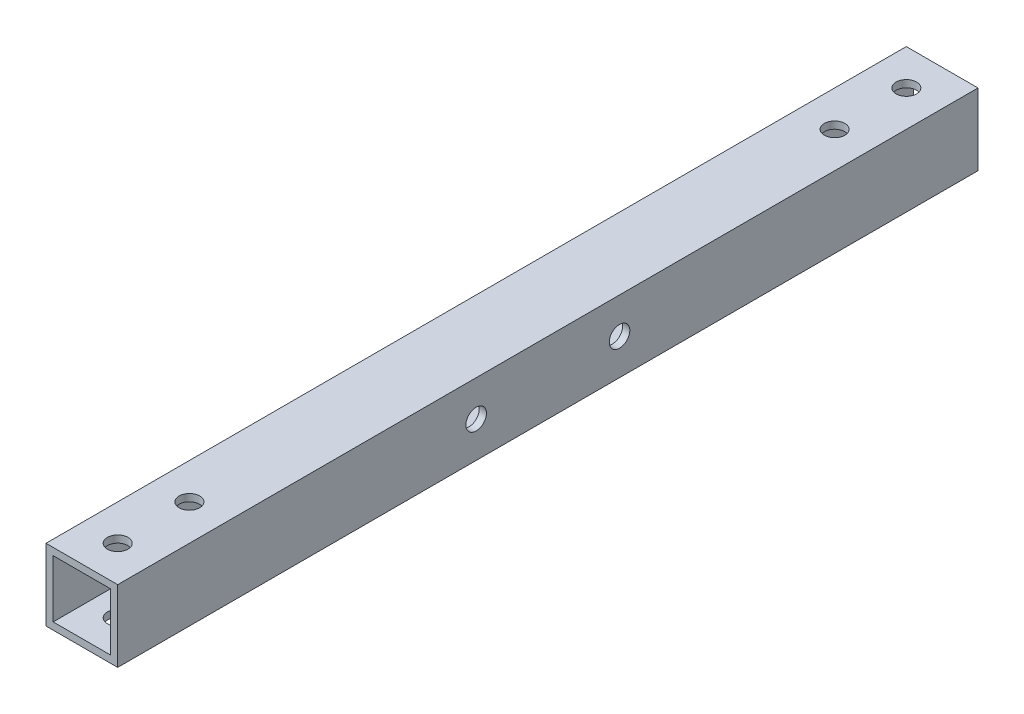
from build123d import *

# Parameters (mm, degrees)
SKETCH_1_W          = 15
SKETCH_1_H          = 15
SKETCH_1_W_2        = 12
SKETCH_1_H_2        = 12
EXTRUDE_1_DEPTH     = 180
SKETCH_3_R          = 2.15
CUT_EXTRUDE_2_DEPTH = 181.779561898
SKETCH_4_R          = 2.15
CUT_EXTRUDE_3_DEPTH = 181.779561898


with BuildPart() as part:
    # ｽｹｯﾁ1 → 押し出し-薄板1 (new body)
    with BuildSketch(Plane.XY):
        Rectangle(SKETCH_1_W, SKETCH_1_H)
        Rectangle(SKETCH_1_W_2, SKETCH_1_H_2, mode=Mode.SUBTRACT)
    extrude(amount=EXTRUDE_1_DEPTH)

    # ｽｹｯﾁ3 → ｶｯﾄ - 押し出し2 (cut, through all)
    with BuildSketch(Plane(origin=(7.5, 0, 0), x_dir=(0, 0, -1), z_dir=(1, 0, 0))):
        with Locations((-75, 0)):
            Circle(SKETCH_3_R)
        with Locations((-105, 0)):
            Circle(SKETCH_3_R)
    extrude(amount=-CUT_EXTRUDE_2_DEPTH, mode=Mode.SUBTRACT)

    # ｽｹｯﾁ4 → ｶｯﾄ - 押し出し3 (cut, through all)
    with BuildSketch(Plane(origin=(0, 7.5, 0), x_dir=(1, 0, 0), z_dir=(0, 1, 0))):
        with Locations(Location((0, -7.5, 0), (0, 0, 270))):
            Circle(SKETCH_4_R)
        with Locations(Location((0, -22.5, 0), (0, 0, 270))):
            Circle(SKETCH_4_R)
        with Locations(Location((0, -172.5, 0), (0, 0, 270))):
            Circle(SKETCH_4_R)
        with Locations(Location((0, -157.5, 0), (0, 0, 270))):
            Circle(SKETCH_4_R)
    extrude(amount=-CUT_EXTRUDE_3_DEPTH, mode=Mode.SUBTRACT)


solid = part.part
